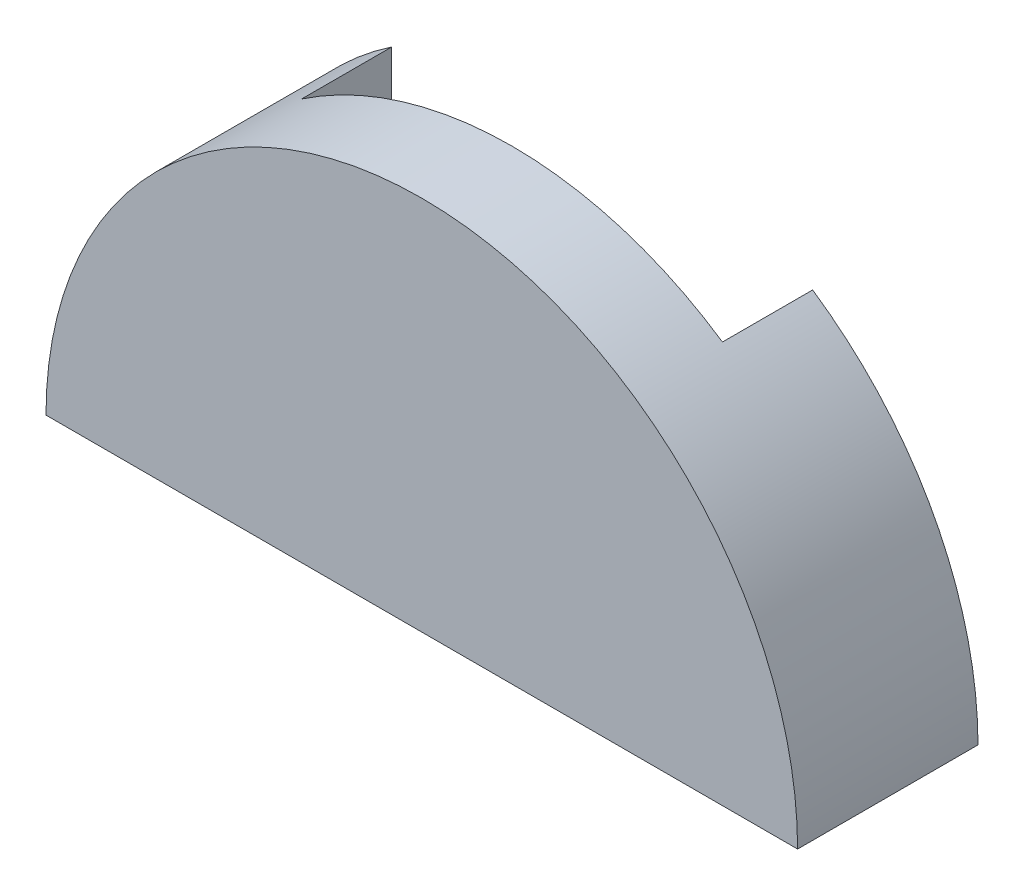
from build123d import *

# Parameters (mm, degrees)
BOSS_EXTRUDE1_DEPTH = 7.62
CUT_EXTRUDE1_DEPTH  = 7.62


with BuildPart() as part:
    # Sketch1 → Boss-Extrude1 (new, symmetric)
    with BuildSketch(Plane.XY):
        with BuildLine():
            ThreePointArc((31.75, 0), (0, 31.75), (-31.75, 0))
            Line((-31.75, 0), (31.75, 0))
        make_face()
    extrude(amount=BOSS_EXTRUDE1_DEPTH, both=True)

    # Sketch2 → Cut-Extrude1 (cut)
    with BuildSketch(Plane.XY):
        with BuildLine():
            ThreePointArc((17.78, 26.304640275), (0, 31.75), (-17.78, 26.304640275))
            Line((-17.78, 26.304640275), (-17.78, 7.62))
            Line((-17.78, 7.62), (17.78, 7.62))
            Line((17.78, 7.62), (17.78, 26.304640275))
        make_face()
    extrude(amount=-CUT_EXTRUDE1_DEPTH, mode=Mode.SUBTRACT)


solid = part.part
